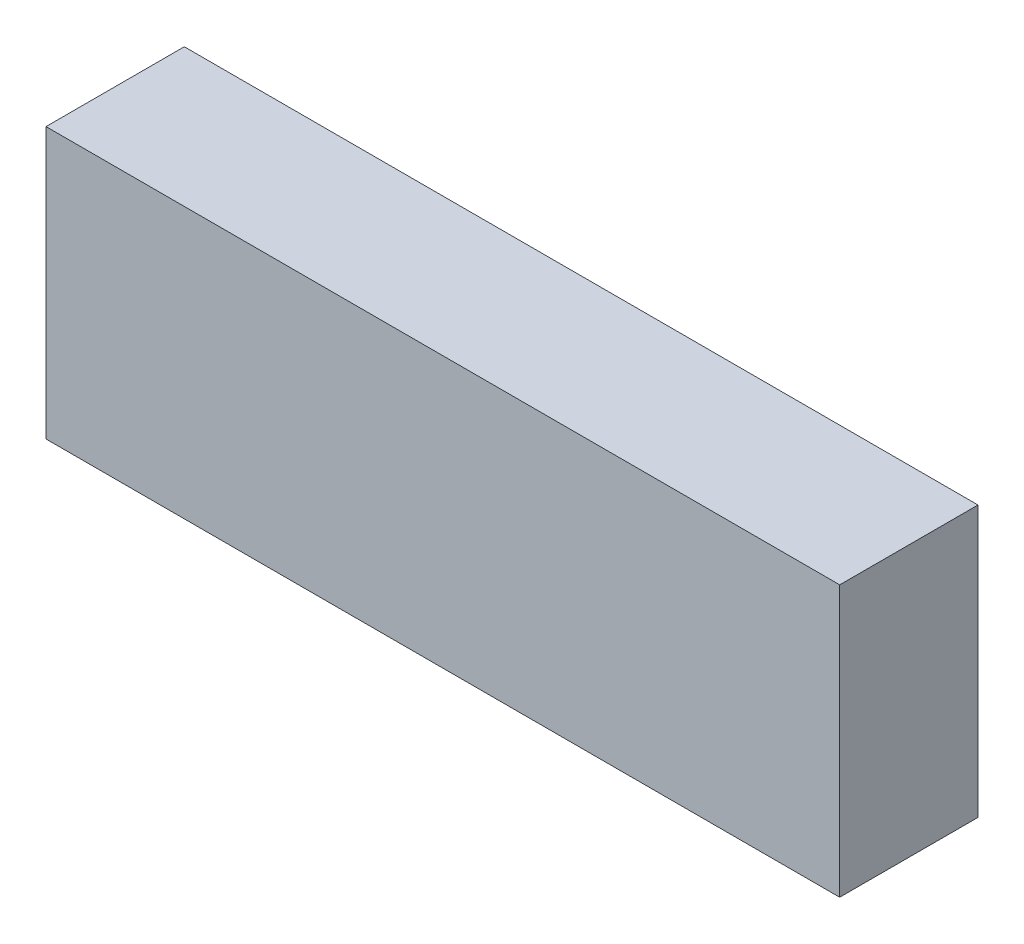
from build123d import *

# Parameters (mm, degrees)
SKETCH_1_W      = 132
SKETCH_1_H      = 45
EXTRUDE_1_DEPTH = 23


with BuildPart() as part:
    # 草圖1 → 伸長1 (new body)
    with BuildSketch(Plane.XY):
        Rectangle(SKETCH_1_W, SKETCH_1_H)
    extrude(amount=EXTRUDE_1_DEPTH)


solid = part.part
